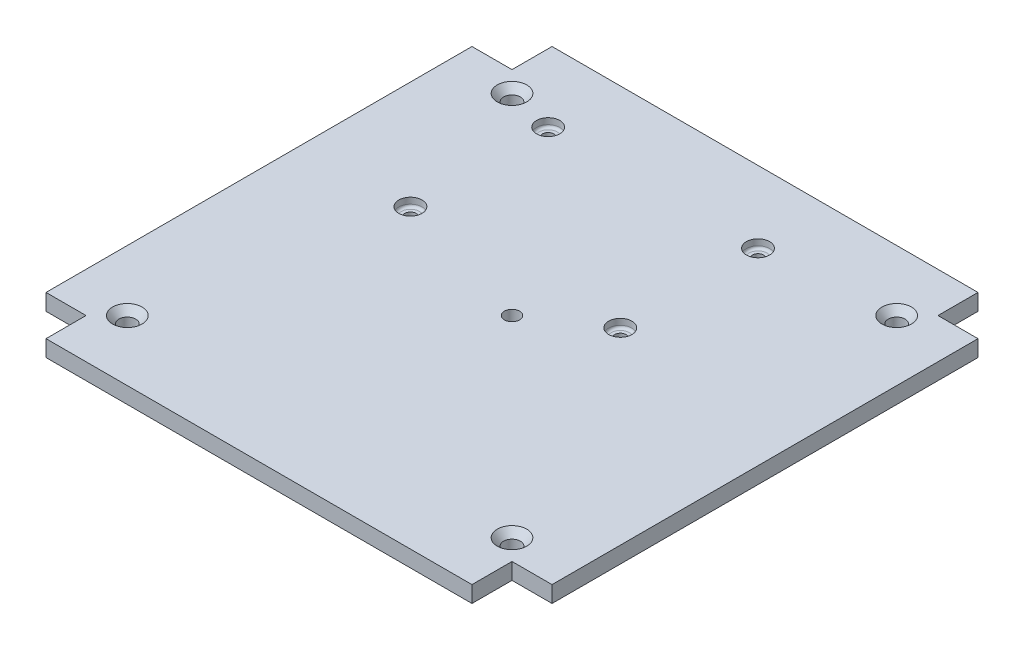
from build123d import *

# Parameters (mm, degrees)
SKETCH1_W                                     = 98
SKETCH1_H                                     = 98
BOSS_EXTRUDE1_DEPTH                           = 3.175
SKETCH2_W                                     = 7.5
SKETCH2_H                                     = 7.5
CUT_EXTRUDE1_DEPTH                            = 70.369161917
F_4_CLEARANCE_HOLE1_D                         = 2.9464
M2_CLEARANCE_HOLE1_D                          = 2.2
CSK_FOR_4_FLAT_HEAD_MACHINE_SCREW1_AT_2_COUNT = 2
CSK_FOR_4_FLAT_HEAD_MACHINE_SCREW1_AT_2_PITCH = 74.5
CSK_FOR_4_FLAT_HEAD_MACHINE_SCREW1_AT_3_COUNT = 2
CSK_FOR_4_FLAT_HEAD_MACHINE_SCREW1_AT_3_PITCH = 105.358910397
CSK_FOR_4_FLAT_HEAD_MACHINE_SCREW1_AT_4_COUNT = 2
CSK_FOR_4_FLAT_HEAD_MACHINE_SCREW1_AT_4_PITCH = 74.5
CUT_EXTRUDE2_DEPTH                            = 70.369161917
SKETCH12_R                                    = 2.25
CUT_EXTRUDE3_DEPTH                            = 1.675
FILLET1_R                                     = 0.5


with BuildPart() as part:
    # Sketch1 → Boss-Extrude1 (new body)
    with BuildSketch(Plane(origin=(0, 0, 0), x_dir=(1, 0, 0), z_dir=(0, 1, 0))):
        Rectangle(SKETCH1_W, SKETCH1_H)
    extrude(amount=BOSS_EXTRUDE1_DEPTH)

    # Sketch2 → Cut-Extrude1 (cut, through all)
    with BuildSketch(Plane(origin=(0, 3.175, 0), x_dir=(1, 0, 0), z_dir=(0, 1, 0))):
        with Locations((45.25, 45.25)):
            Rectangle(SKETCH2_W, SKETCH2_H)
        with Locations((-45.25, 45.25)):
            Rectangle(SKETCH2_W, SKETCH2_H)
        with Locations((45.25, -45.25)):
            Rectangle(SKETCH2_W, SKETCH2_H)
        with Locations((-45.25, -45.25)):
            Rectangle(SKETCH2_W, SKETCH2_H)
    extrude(amount=-CUT_EXTRUDE1_DEPTH, mode=Mode.SUBTRACT)

    # #4 Clearance Hole1 (through all)
    with Locations(Plane(origin=(0, 3.175, 0), x_dir=(1, 0, 0), z_dir=(0, 1, 0))):
        with Locations((0, 0)):
            Hole(F_4_CLEARANCE_HOLE1_D / 2)

    # M2 Clearance Hole1 (through all)
    with Locations(Plane(origin=(0, 3.175, 0), x_dir=(1, 0, 0), z_dir=(0, 1, 0))):
        with Locations((-28.095, 35.095), (12.545, 35.095), (12.545, 8.425), (-28.095, 8.425)):
            Hole(M2_CLEARANCE_HOLE1_D / 2)

    # Sketch9 → CSK for #4 Flat Head Machine Screw1 (revolve, cut)
    with BuildSketch(Plane(origin=(37.25, 3.175, 37.25), x_dir=(0, 0, 1), z_dir=(1, 0, 0))):
        Polygon((0, 0), (0, 3.175), (1.63195, 3.175), (1.63195, 1.409834001), (2.8575, 0), align=None)
    csk_for_4_flat_head_machine_screw1 = revolve(axis=Axis((37.25, 9.525, 37.25), (0, -1, 0)), mode=Mode.SUBTRACT)

    # CSK for #4 Flat Head Machine Screw1 at 2: CSK for #4 Flat Head Machine Screw1 ×2
    with Locations(*[(-i * CSK_FOR_4_FLAT_HEAD_MACHINE_SCREW1_AT_2_PITCH, 0, 0) for i in range(1, CSK_FOR_4_FLAT_HEAD_MACHINE_SCREW1_AT_2_COUNT)]):
        add(csk_for_4_flat_head_machine_screw1, mode=Mode.SUBTRACT)

    # CSK for #4 Flat Head Machine Screw1 at 3: CSK for #4 Flat Head Machine Screw1 ×2
    with Locations(*[Vector(-0.7071067811865502, 0, -0.7071067811865448) * (i * CSK_FOR_4_FLAT_HEAD_MACHINE_SCREW1_AT_3_PITCH) for i in range(1, CSK_FOR_4_FLAT_HEAD_MACHINE_SCREW1_AT_3_COUNT)]):
        add(csk_for_4_flat_head_machine_screw1, mode=Mode.SUBTRACT)

    # CSK for #4 Flat Head Machine Screw1 at 4: CSK for #4 Flat Head Machine Screw1 ×2
    with Locations(*[(0, 0, -i * CSK_FOR_4_FLAT_HEAD_MACHINE_SCREW1_AT_4_PITCH) for i in range(1, CSK_FOR_4_FLAT_HEAD_MACHINE_SCREW1_AT_4_COUNT)]):
        add(csk_for_4_flat_head_machine_screw1, mode=Mode.SUBTRACT)

    # Sketch11 → Cut-Extrude2 (cut, through all)
    with BuildSketch(Plane(origin=(0, 3.175, 0), x_dir=(1, 0, 0), z_dir=(0, 1, 0))):
        Polygon((-49, -41.246), (-41.246, -41.246), (-41.246, -49), (-41.5, -49), (-41.5, -41.5), (-49, -41.5), align=None)
        Polygon((41.246, -49), (41.246, -41.246), (49, -41.246), (49, -41.5), (41.5, -41.5), (41.5, -49), align=None)
        Polygon((49, 41.246), (41.246, 41.246), (41.246, 49), (41.5, 49), (41.5, 41.5), (49, 41.5), align=None)
        Polygon((-41.246, 49), (-41.246, 41.246), (-49, 41.246), (-49, 41.5), (-41.5, 41.5), (-41.5, 49), align=None)
    extrude(amount=-CUT_EXTRUDE2_DEPTH, mode=Mode.SUBTRACT)

    # Sketch12 → Cut-Extrude3 (cut)
    with BuildSketch(Plane(origin=(0, 3.175, 0), x_dir=(1, 0, 0), z_dir=(0, 1, 0))):
        with Locations(Location((-28.095, 35.095, 0), (0, 0, 270))):
            Circle(SKETCH12_R)
        with Locations(Location((12.545, 35.095, 0), (0, 0, 270))):
            Circle(SKETCH12_R)
        with Locations(Location((12.545, 8.425, 0), (0, 0, 270))):
            Circle(SKETCH12_R)
        with Locations(Location((-28.095, 8.425, 0), (0, 0, 270))):
            Circle(SKETCH12_R)
    extrude(amount=-CUT_EXTRUDE3_DEPTH, mode=Mode.SUBTRACT)

    # Fillet1
    fillet1_edges = [part.edges().sort_by_distance(p)[0] for p in [
        (-28.095, 1.5, -37.345),
        (12.545, 1.5, -37.345),
        (12.545, 1.5, -10.675),
        (-28.095, 1.5, -10.675),
    ]]
    fillet(fillet1_edges, radius=FILLET1_R)


solid = part.part
